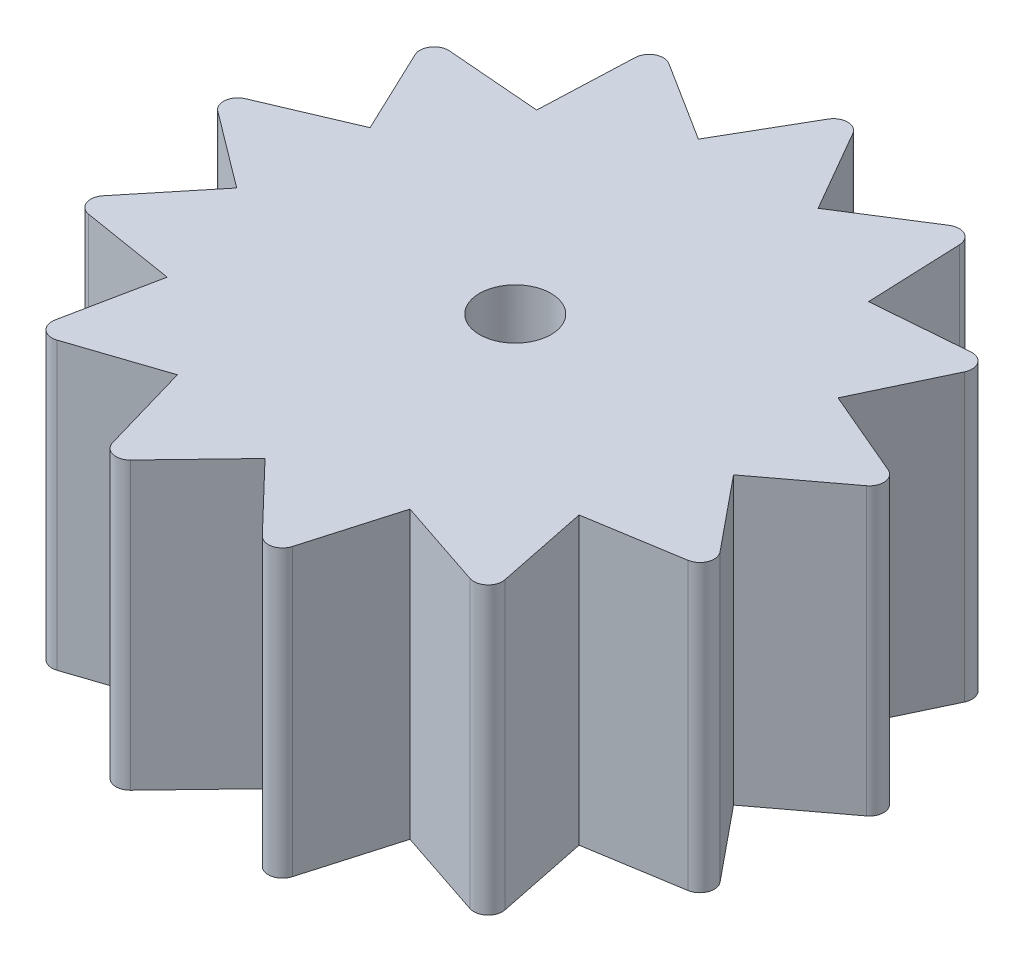
from build123d import *

# Parameters (mm, degrees)
SKETCH1_R           = 0.5
BOSS_EXTRUDE1_DEPTH = 4
CUT_EXTRUDE1_DEPTH  = 3
FILLET1_R           = 0.2


with BuildPart() as part:
    # Sketch1 → Boss-Extrude1 (new body)
    with BuildSketch(Plane(origin=(0, 0, 0), x_dir=(1, 0, 0), z_dir=(0, 1, 0))):
        Polygon((2.320929304, 2.619787619), (3.990706765, 2.754585991), (3.272556849, 1.241117105), (4.813715291, 0.584490857), (3.474481059, -0.421878381), (4.533959656, -1.719504088), (2.880443531, -1.988226614), (3.215528503, -3.629581369), (1.626531102, -3.09909609), (1.160458522, -4.708165299), (0, -3.5), (-1.160458522, -4.708165299), (-1.626531102, -3.09909609), (-3.215528503, -3.629581369), (-2.880443531, -1.988226614), (-4.533959656, -1.719504088), (-3.474481059, -0.421878381), (-4.813715291, 0.584490857), (-3.272556849, 1.241117105), (-3.990706765, 2.754585991), (-2.320929304, 2.619787619), (-2.253475412, 4.293638671), (-0.837604825, 3.398296361), (0, 4.849070475), (0.837604825, 3.398296361), (2.253475412, 4.293638671), align=None)
        with Locations(Location((0, 0, 0), (0, 0, 270))):
            Circle(SKETCH1_R, mode=Mode.SUBTRACT)
    extrude(amount=BOSS_EXTRUDE1_DEPTH)

    # Sketch2 → Cut-Extrude1 (cut)
    with BuildSketch(Plane.XZ):
        Polygon((-2.356515562, -0.355187571), (-2.394012407, -0.73845503), (-2.147128813, -1.03400274), (-2.069989712, -1.411295089), (-1.746960246, -1.620942227), (-1.562039347, -1.958735387), (-1.191566595, -2.063853884), (-0.915294931, -2.332133449), (-0.530297023, -2.323383066), (-0.187222544, -2.49831122), (0.178091766, -2.376469467), (0.557485388, -2.442503076), (0.870656321, -2.218396127), (1.252658297, -2.169667815), (1.485859241, -1.863208555), (1.836527019, -1.704048047), (1.969037046, -1.342466727), (2.257212255, -1.087016131), (2.27725727, -0.702440839), (2.477334277, -0.373398063), (2.383133191, 0), (2.477334277, 0.373398063), (2.27725727, 0.702440839), (2.257212255, 1.087016131), (1.969037046, 1.342466727), (1.836527019, 1.704048047), (1.485859241, 1.863208555), (1.252658297, 2.169667815), (0.870656321, 2.218396127), (0.557485388, 2.442503076), (0.178091766, 2.376469467), (-0.187222544, 2.49831122), (-0.530297023, 2.323383066), (-0.915294931, 2.332133449), (-1.191566595, 2.063853884), (-1.562039347, 1.958735387), (-1.746960246, 1.620942227), (-2.069989712, 1.411295089), (-2.147128813, 1.03400274), (-2.394012407, 0.73845503), (-2.356515562, 0.355187571), (-2.505316594, 0), align=None)
    extrude(amount=-CUT_EXTRUDE1_DEPTH, mode=Mode.SUBTRACT)

    # Fillet1
    fillet1_edges = [part.edges().sort_by_distance(p)[0] for p in [
        (4.813715291, 2, -0.584490857),
        (4.533959656, 2, 1.719504088),
        (3.215528503, 2, 3.629581369),
        (1.160458522, 2, 4.708165299),
        (-1.160458522, 2, 4.708165299),
        (-3.215528503, 2, 3.629581369),
        (-4.533959656, 2, 1.719504088),
        (-4.813715291, 2, -0.584490857),
        (-3.990706765, 2, -2.754585991),
        (-2.253475412, 2, -4.293638671),
        (0, 2, -4.849070475),
        (2.253475412, 2, -4.293638671),
        (3.990706765, 2, -2.754585991),
    ]]
    fillet(fillet1_edges, radius=FILLET1_R)


solid = part.part
